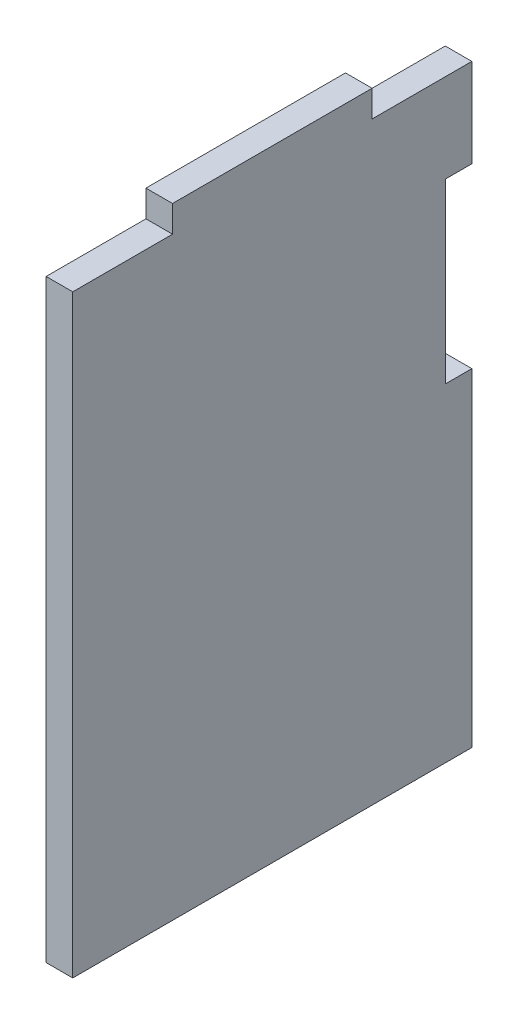
from build123d import *

# Parameters (mm, degrees)
SKETCH1_W           = 45
SKETCH1_H           = 70
BOSS_EXTRUDE1_DEPTH = 3
SKETCH2_W           = 11.25
SKETCH2_H           = 3
SKETCH2_W_2         = 3
SKETCH2_H_2         = 20
CUT_EXTRUDE1_DEPTH  = 10


with BuildPart() as part:
    # Sketch1 → Boss-Extrude1 (new body)
    with BuildSketch(Plane(origin=(0, 0, 0), x_dir=(0, 0, -1), z_dir=(1, 0, 0))):
        with Locations((22.5, 35)):
            Rectangle(SKETCH1_W, SKETCH1_H)
    extrude(amount=BOSS_EXTRUDE1_DEPTH)

    # Sketch2 → Cut-Extrude1 (cut)
    with BuildSketch(Plane(origin=(3, 0, 0), x_dir=(0, 0, -1), z_dir=(1, 0, 0))):
        with Locations((39.375, 68.5)):
            Rectangle(SKETCH2_W, SKETCH2_H)
        with Locations((5.625, 68.5)):
            Rectangle(SKETCH2_W, SKETCH2_H)
        with Locations((43.5, 47)):
            Rectangle(SKETCH2_W_2, SKETCH2_H_2)
    extrude(amount=-CUT_EXTRUDE1_DEPTH, mode=Mode.SUBTRACT)


solid = part.part
